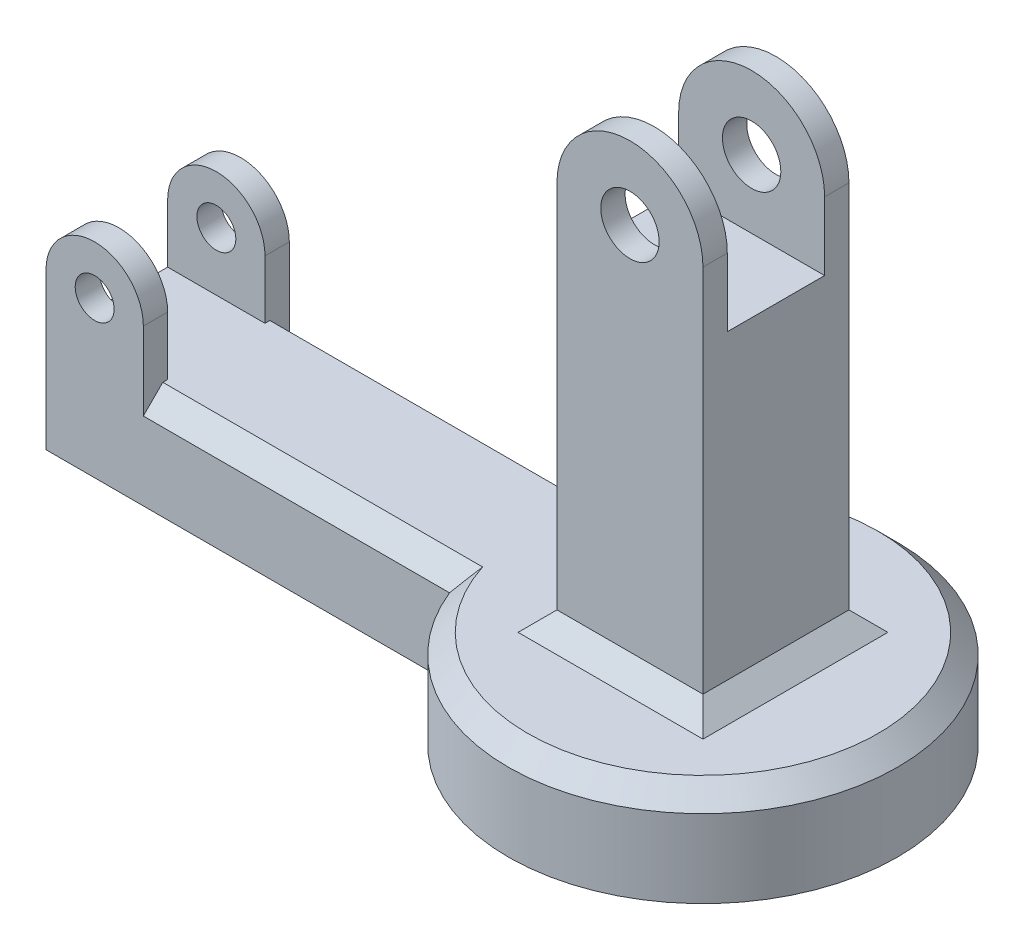
from build123d import *

# Parameters (mm, degrees)
SKETCH1_R           = 100
BOSS_EXTRUDE1_DEPTH = 50
SKETCH2_W           = 300
SKETCH2_H           = 75
BOSS_EXTRUDE2_DEPTH = 50
SKETCH3_R           = 10
SKETCH3_R_2         = 15
BOSS_EXTRUDE3_DEPTH = 37.5
SKETCH4_W           = 75
SKETCH4_H           = 72.5
SKETCH4_W_2         = 50
SKETCH4_H_2         = 55
CUT_EXTRUDE2_DEPTH  = 25
CHAMFER1_SIZE       = 10
CHAMFER2_SIZE       = 10


with BuildPart() as part:
    # Sketch1 → Boss-Extrude1 (new body)
    with BuildSketch(Plane(origin=(0, 0, 0), x_dir=(1, 0, 0), z_dir=(0, 1, 0))):
        with Locations(Location((0, 0, 0), (0, 0, 270))):
            Circle(SKETCH1_R)
    extrude(amount=BOSS_EXTRUDE1_DEPTH)

    # Sketch2 → Boss-Extrude2 (add)
    with BuildSketch(Plane(origin=(0, 50, 0), x_dir=(1, 0, 0), z_dir=(0, 1, 0))):
        with Locations((-150, 0)):
            Rectangle(SKETCH2_W, SKETCH2_H)
    extrude(amount=-BOSS_EXTRUDE2_DEPTH)

    # Sketch3 → Boss-Extrude3 (add, symmetric)
    # profile 1 of 2: a face of its own
    with BuildSketch(Plane.XY):
        with BuildLine():
            Line((-300, 50), (-300, 80))
            ThreePointArc((-300, 80), (-275, 105), (-250, 80))
            Line((-250, 80), (-250, 50))
            Line((-250, 50), (-300, 50))
        make_face()
        with Locations((-275, 80)):
            Circle(SKETCH3_R, mode=Mode.SUBTRACT)
    # profile 2 of 2: a face of its own
    with BuildSketch(Plane.XY):
        with BuildLine():
            Line((-37.5, 50), (37.5, 50))
            Line((37.5, 50), (37.5, 250))
            ThreePointArc((37.5, 250), (0, 287.5), (-37.5, 250))
            Line((-37.5, 250), (-37.5, 50))
        make_face()
        with Locations((0, 250)):
            Circle(SKETCH3_R_2, mode=Mode.SUBTRACT)
    extrude(amount=BOSS_EXTRUDE3_DEPTH, both=True)

    # Sketch4 → Cut-Extrude2 (cut, symmetric)
    with BuildSketch(Plane.XY):
        with Locations((0, 251.25)):
            Rectangle(SKETCH4_W, SKETCH4_H)
        with Locations((-275, 77.5)):
            Rectangle(SKETCH4_W_2, SKETCH4_H_2)
    extrude(amount=CUT_EXTRUDE2_DEPTH, both=True, mode=Mode.SUBTRACT)

    # Chamfer1
    chamfer1_edges = [part.edges().sort_by_distance(p)[0] for p in [
        (-171.351240544, 50, -37.5),
        (100, 50, 0),
        (-171.351240544, 50, 37.5),
    ]]
    chamfer(chamfer1_edges, length=CHAMFER1_SIZE)

    # Chamfer2
    chamfer2_edges = [part.edges().sort_by_distance(p)[0] for p in [
        (0, 50, 37.5),
        (0, 50, -37.5),
        (-37.5, 50, 0),
        (37.5, 50, 0),
    ]]
    chamfer(chamfer2_edges, length=CHAMFER2_SIZE)


solid = part.part
